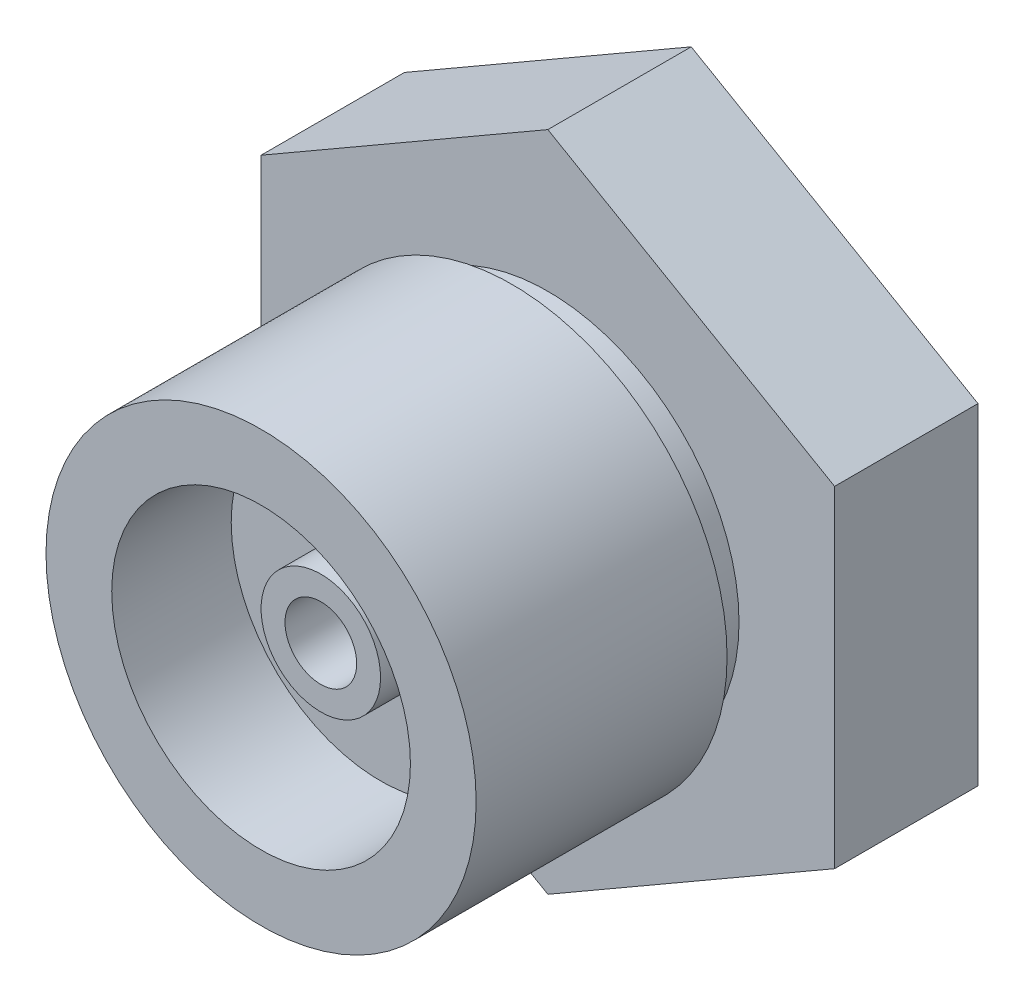
from build123d import *

# Parameters (mm, degrees)
SKETCH_2_R          = 12.5
SKETCH_2_R_2        = 5
CUT_EXTRUDE_1_DEPTH = 10
SKETCH_3_R          = 3
CUT_EXTRUDE_2_DEPTH = 10
SKETCH_4_R          = 5
CUT_EXTRUDE_3_DEPTH = 5
EXTRUDE_1_DEPTH     = 12


with BuildPart() as part:
    # 草图1 → 旋转1 (revolve)
    with BuildSketch(Plane(origin=(0, 0, 0), x_dir=(0, 0, -1), z_dir=(1, 0, 0)), mode=Mode.PRIVATE) as revolve_1_sk:
        Polygon((0, 0), (0, 24), (-12, 24), (-12, 16), (-15, 16), (-15, 18), (-36, 18), (-36, 0), align=None)
    revolve(revolve_1_sk.sketch.rotate(Axis((0, 0, 0), (0, 0, 1)), 90), axis=Axis((0, 0, 0), (0, 0, 1)))

    # 草图2 → 切除-拉伸1 (cut)
    with BuildSketch(Plane.XY.offset(36)):
        Circle(SKETCH_2_R)
        Circle(SKETCH_2_R_2, mode=Mode.SUBTRACT)
    extrude(amount=-CUT_EXTRUDE_1_DEPTH, mode=Mode.SUBTRACT)

    # 草图3 → 切除-拉伸2 (cut)
    with BuildSketch(Plane.XY.offset(36)):
        Circle(SKETCH_3_R)
    extrude(amount=-CUT_EXTRUDE_2_DEPTH, mode=Mode.SUBTRACT)

    # 草图4 → 切除-拉伸3 (cut)
    with BuildSketch(Plane.XY.offset(36)):
        Circle(SKETCH_4_R)
    extrude(amount=-CUT_EXTRUDE_3_DEPTH, mode=Mode.SUBTRACT)

    # 草图5 → 凸台-拉伸1 (add)
    with BuildSketch(Plane(origin=(0, 0, 0), x_dir=(-1, 0, 0), z_dir=(0, 0, -1))):
        Polygon((0, 27.712812921), (-24, 13.856406461), (-24, -13.856406461), (0, -27.712812921), (24, -13.856406461), (24, 13.856406461), align=None)
    extrude(amount=-EXTRUDE_1_DEPTH)


solid = part.part
